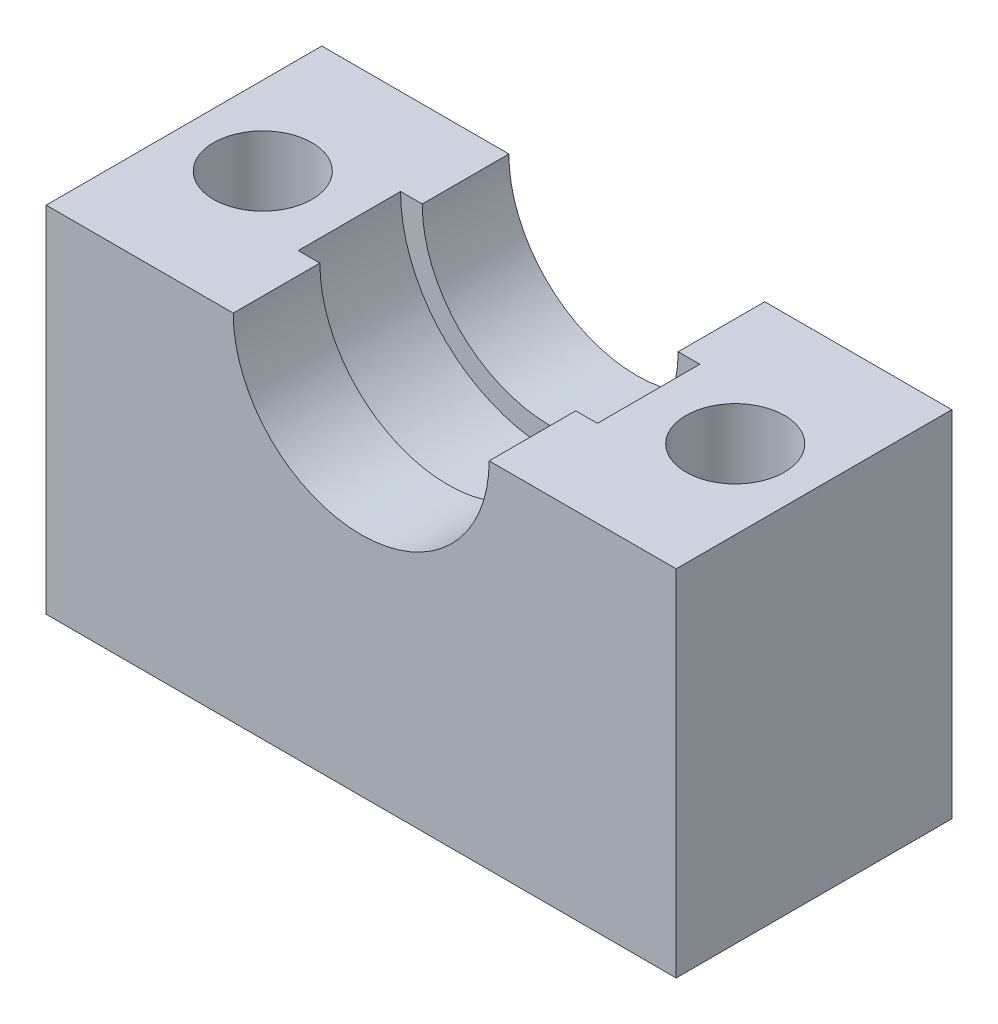
from build123d import *

# Parameters (mm, degrees)
SKETCH_1_W               = 32
SKETCH_1_H               = 14
EXTRUDE_1_DEPTH          = 18
SKETCH_3_R               = 7.6
CUT_EXTRUDE_1_DEPTH      = 2.6
CUT_EXTRUDE_2_DEPTH      = 26.079872408
CUT_EXTRUDE_2_DEPTH_BACK = 26.079872408
SKETCH_4_R               = 6.5
SKETCH_5_R               = 2.5
CUT_EXTRUDE_3_DEPTH      = 5.5


with BuildPart() as part:
    # 草圖1 → 填料-伸長1 (new body)
    with BuildSketch(Plane(origin=(0, 0, 0), x_dir=(1, 0, 0), z_dir=(0, 1, 0))):
        Rectangle(SKETCH_1_W, SKETCH_1_H)
    extrude(amount=EXTRUDE_1_DEPTH)

    # 草圖3 → 除料-伸長1 (cut, symmetric)
    with BuildSketch(Plane.XY):
        with Locations((0, 18)):
            Circle(SKETCH_3_R)
    extrude(amount=CUT_EXTRUDE_1_DEPTH, both=True, mode=Mode.SUBTRACT)

    # 草圖4 → 除料-伸長2 (cut, two sides: drawn at the far end of the back side and taken through both)
    with BuildSketch(Plane.XY.offset(-CUT_EXTRUDE_2_DEPTH_BACK)):
        with Locations((0, 18)):
            Circle(SKETCH_4_R)
    extrude(amount=CUT_EXTRUDE_2_DEPTH + CUT_EXTRUDE_2_DEPTH_BACK, mode=Mode.SUBTRACT)

    # 草圖5 → 除料-伸長3 (cut)
    with BuildSketch(Plane(origin=(0, 18, 0), x_dir=(1, 0, 0), z_dir=(0, 1, 0))):
        with Locations(Location((-12, 0, 0), (0, 0, 270))):
            Circle(SKETCH_5_R)
        with Locations(Location((12, 0, 0), (0, 0, 90))):
            Circle(SKETCH_5_R)
    cut_extrude_3 = extrude(amount=-CUT_EXTRUDE_3_DEPTH, mode=Mode.SUBTRACT)

    # Mirror1: 除料-伸長3 across plane
    add(cut_extrude_3.mirror(Plane.ZX.offset(9)), mode=Mode.SUBTRACT)


solid = part.part
